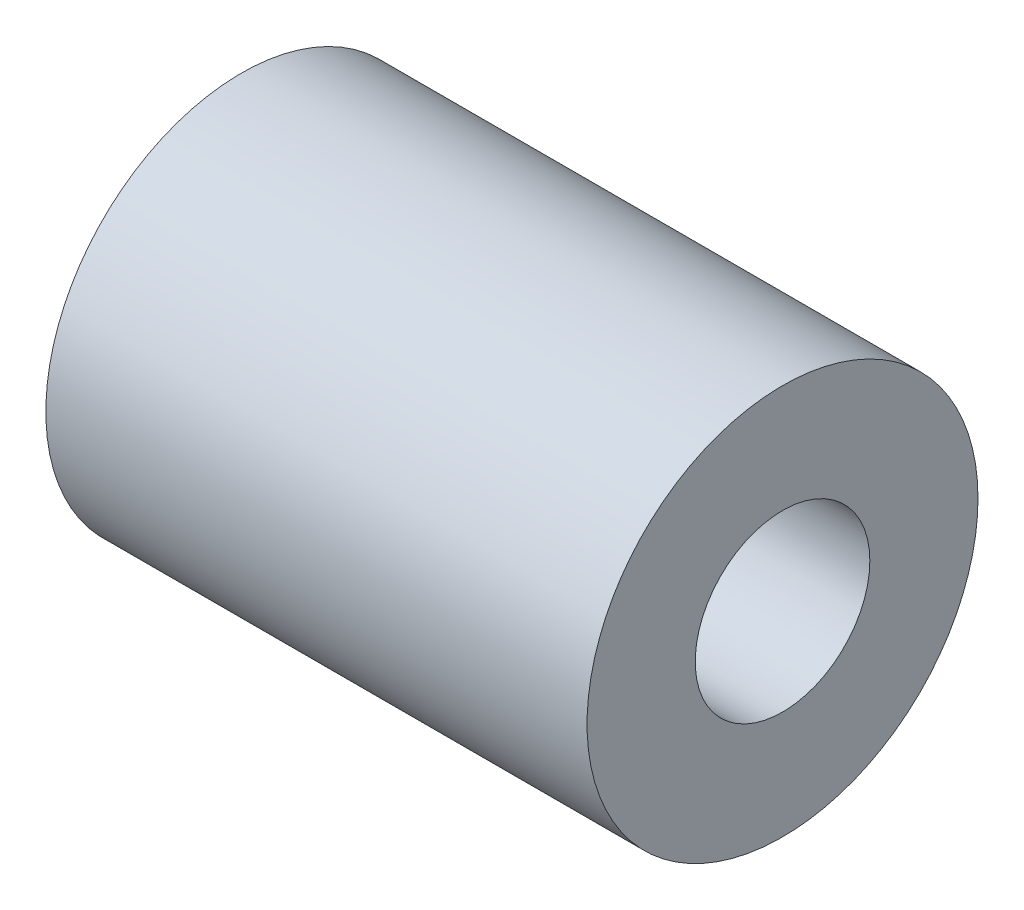
from build123d import *

# Parameters (mm, degrees)
SKETCH1_R           = 5.715
SKETCH1_R_2         = 2.5527
BOSS_EXTRUDE1_DEPTH = 15.8242


with BuildPart() as part:
    # Sketch1 → Boss-Extrude1 (new body)
    with BuildSketch(Plane(origin=(0, 0, 0), x_dir=(0, 0, -1), z_dir=(1, 0, 0))):
        Circle(SKETCH1_R)
        Circle(SKETCH1_R_2, mode=Mode.SUBTRACT)
    extrude(amount=BOSS_EXTRUDE1_DEPTH)


solid = part.part
